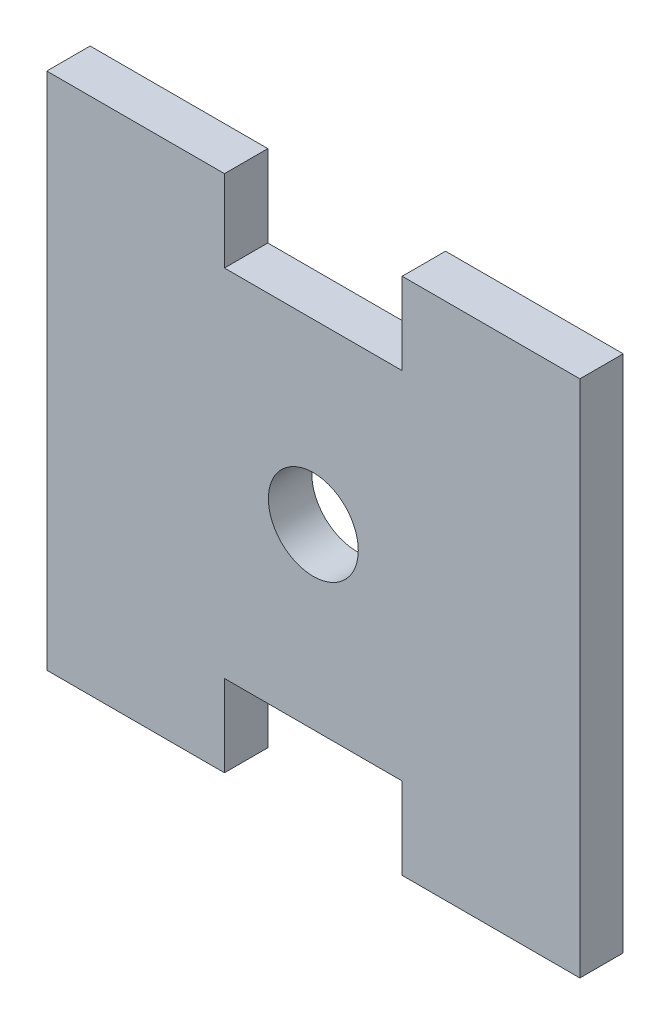
from build123d import *

# Parameters (mm, degrees)
SKETCH1_R           = 3.2131
BOSS_EXTRUDE1_DEPTH = 3.0988


with BuildPart() as part:
    # Sketch1 → Boss-Extrude1 (new body)
    with BuildSketch(Plane.XY):
        Polygon((-19.05, -18.542), (-19.05, -12.7), (-19.05, 12.7), (-19.05, 18.542), (-6.35, 18.542), (-6.35, 12.7), (6.35, 12.7), (6.35, 18.542), (19.05, 18.542), (19.05, 12.7), (19.05, -12.7), (19.05, -18.542), (6.35, -18.542), (6.35, -12.7), (-6.35, -12.7), (-6.35, -18.542), align=None)
        Circle(SKETCH1_R, mode=Mode.SUBTRACT)
    extrude(amount=BOSS_EXTRUDE1_DEPTH)


solid = part.part
